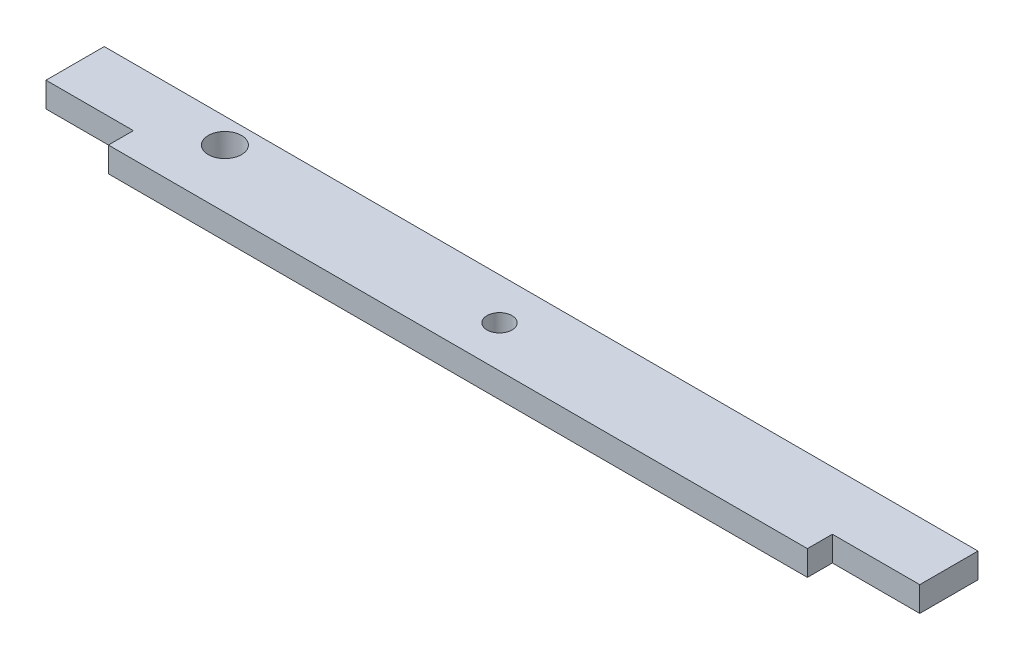
from build123d import *

# Parameters (mm, degrees)
SKETCH1_W           = 105
SKETCH1_H           = 10
SKETCH1_R           = 1.5
BOSS_EXTRUDE1_DEPTH = 3
SKETCH2_W           = 10.5
SKETCH2_H           = 3
CUT_EXTRUDE1_DEPTH  = 53.82281704
SKETCH3_R           = 2
CUT_EXTRUDE3_DEPTH  = 10


with BuildPart() as part:
    # Sketch1 → Boss-Extrude1 (new body)
    with BuildSketch(Plane(origin=(0, 0, 0), x_dir=(1, 0, 0), z_dir=(0, 1, 0))):
        Rectangle(SKETCH1_W, SKETCH1_H)
        with Locations(Location((0, 0, 0), (0, 0, 270))):
            Circle(SKETCH1_R, mode=Mode.SUBTRACT)
    extrude(amount=BOSS_EXTRUDE1_DEPTH)

    # Sketch2 → Cut-Extrude1 (cut, through all)
    with BuildSketch(Plane(origin=(0, 3, 0), x_dir=(1, 0, 0), z_dir=(0, 1, 0))):
        with Locations((-47.25, -3.5)):
            Rectangle(SKETCH2_W, SKETCH2_H)
    cut_extrude1 = extrude(amount=-CUT_EXTRUDE1_DEPTH, mode=Mode.SUBTRACT)

    # Mirror2: Cut-Extrude1 across plane
    add(cut_extrude1.mirror(Plane(origin=(0, 0, 0), x_dir=(0, 0, 1), z_dir=(1, 0, 0))), mode=Mode.SUBTRACT)

    # Sketch3 → Cut-Extrude3 (cut)
    with BuildSketch(Plane.XZ):
        with Locations(Location((-35, -2, 0), (0, 0, 270))):
            Circle(SKETCH3_R)
    extrude(amount=-CUT_EXTRUDE3_DEPTH, mode=Mode.SUBTRACT)


solid = part.part
